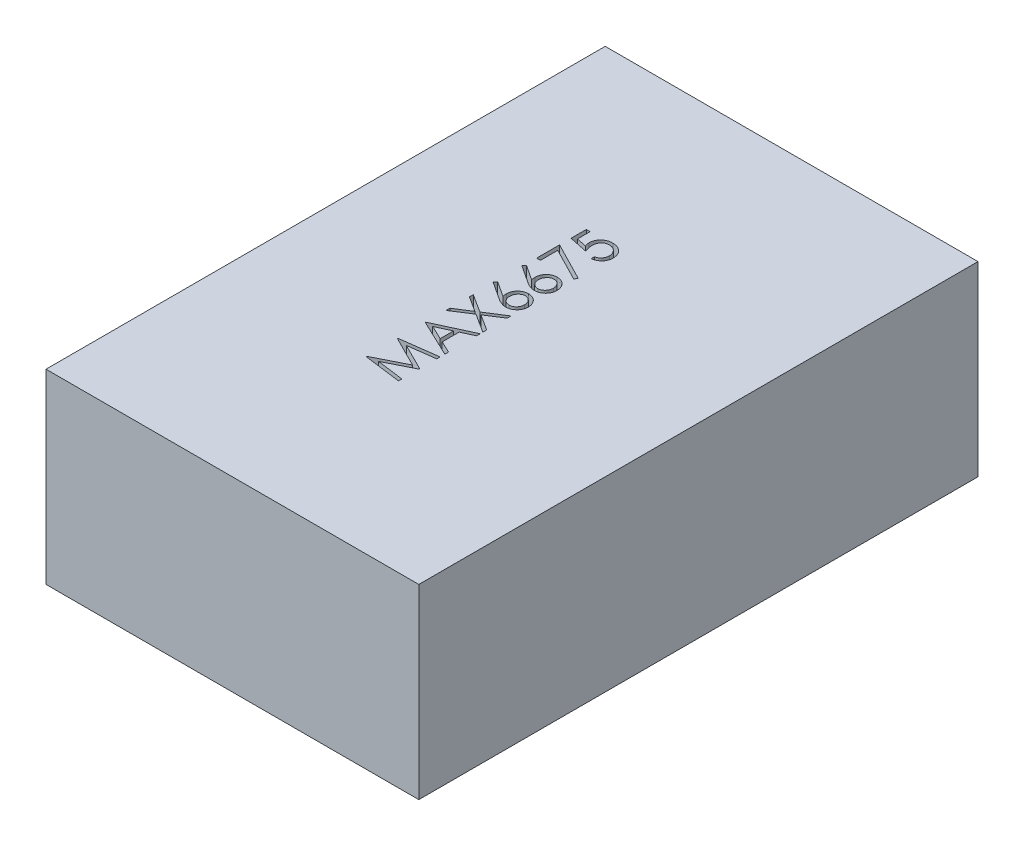
from build123d import *

# Parameters (mm, degrees)
SKETCH1_W           = 20
SKETCH1_H           = 30
BOSS_EXTRUDE1_DEPTH = 10
CUT_EXTRUDE1_DEPTH  = 2


with BuildPart() as part:
    # Sketch1 → Boss-Extrude1 (new body)
    with BuildSketch(Plane(origin=(0, 0, 0), x_dir=(1, 0, 0), z_dir=(0, 1, 0))):
        Rectangle(SKETCH1_W, SKETCH1_H)
    extrude(amount=BOSS_EXTRUDE1_DEPTH)

    # Sketch2 → Cut-Extrude1 (cut)
    # profile 1 of 7: a face of its own
    with BuildSketch(Plane(origin=(0, 10, 0), x_dir=(1, 0, 0), z_dir=(0, 1, 0))):
        Polygon((0, -6.08974359), (-2, -5.825721154), (-2, -5.800080128), (-0.358974359, -4.974358974), (-2, -4.150641026), (-2, -4.124599359), (0, -3.858974359), (0, -4.039262821), (-1.439102564, -4.230769231), (0, -4.952724359), (0, -4.993189103), (-1.442307692, -5.717948718), (0, -5.909054487), align=None)
    # profile 2 of 7: a face of its own
    with BuildSketch(Plane(origin=(0, 10, 0), x_dir=(1, 0, 0), z_dir=(0, 1, 0))):
        Polygon((-2, -2.628205128), (0, -1.705128205), (0, -1.900240385), (-0.641025641, -2.195913462), (-0.641025641, -3.102564103), (0, -3.406650641), (0, -3.602564103), (-2, -2.653846154), align=None)
        Polygon((-1.610176282, -2.643028846), (-0.846153846, -3.005208333), (-0.846153846, -2.290464744), align=None, mode=Mode.SUBTRACT)
    # profile 3 of 7: a face of its own
    with BuildSketch(Plane(origin=(0, 10, 0), x_dir=(1, 0, 0), z_dir=(0, 1, 0))):
        Polygon((-2, -1.538461538), (-2, -1.331330128), (-1.181891026, -0.807692308), (-2, -0.284054487), (-2, -0.076923077), (-1.020032051, -0.703926282), (0, -0.051282051), (0, -0.258413462), (-0.858173077, -0.807692308), (0, -1.356971154), (0, -1.564102564), (-1.020032051, -0.911057692), align=None)
    # profile 4 of 7: a face of its own
    with BuildSketch(Plane(origin=(0, 10, 0), x_dir=(1, 0, 0), z_dir=(0, 1, 0))):
        with BuildLine():
            Line((-2.051282051, 1.038461538), (-1.942708333, 1.176682692))
            Line((-1.942708333, 1.176682692), (-1.134615385, 0.648237179))
            add(Edge.make_bspline(
                [(-1.134615385, 0.648237179), (-1.140223305, 0.683420195), (-1.151162188, 0.752048644), (-1.152966728, 0.821514872), (-1.153846154, 0.85536859)],
                knots=[0, 0, 0, 0, 1.025318673, 2, 2, 2, 2], degree=3))
            add(Edge.make_bspline(
                [(-1.153846154, 0.85536859), (-1.153299804, 0.875695731), (-1.152224332, 0.915709102), (-1.143947845, 0.974455846), (-1.130904925, 1.030906669), (-1.111892204, 1.084827582), (-1.087605157, 1.136412173), (-1.058497181, 1.185956286), (-1.023065556, 1.232529296), (-0.983484842, 1.276728303), (-0.939649317, 1.316864276), (-0.893124314, 1.352371016), (-0.843913513, 1.382359423), (-0.792027979, 1.406251354), (-0.737873866, 1.425345238), (-0.681239969, 1.438937759), (-0.622030702, 1.447063572), (-0.581756259, 1.448160661), (-0.561298077, 1.448717949)],
                knots=[0, 0, 0, 0, 1.043709831, 2.054511743, 3.041122595, 4.01515914, 4.98481438, 5.965901842, 6.960491961, 7.985277438, 9.0096037, 10.00832444, 10.987059228, 11.962929573, 12.936966118, 13.931840027, 14.949438142, 16, 16, 16, 16], degree=3))
            add(Edge.make_bspline(
                [(-0.561298077, 1.448717949), (-0.533308627, 1.447906722), (-0.478232014, 1.446310421), (-0.398031716, 1.430337162), (-0.321672093, 1.405701555), (-0.250474443, 1.369925289), (-0.183945646, 1.326329403), (-0.125190964, 1.272511651), (-0.072791153, 1.211142169), (-0.028992085, 1.14171368), (0.006782366, 1.06700544), (0.032476451, 0.988518047), (0.048295665, 0.907016962), (0.050278855, 0.851700024), (0.051282051, 0.823717949)],
                knots=[0, 0, 0, 0, 1.031403119, 2.029557249, 3.004870281, 3.983165322, 4.960181699, 5.929903783, 6.912123683, 7.928973898, 8.949315281, 9.960468141, 10.968302741, 12, 12, 12, 12], degree=3))
            add(Edge.make_bspline(
                [(0.051282051, 0.823717949), (0.050411272, 0.796804416), (0.048686412, 0.743493419), (0.033241009, 0.665091246), (0.008384705, 0.589622909), (-0.026577342, 0.518057149), (-0.069992888, 0.451652249), (-0.121895145, 0.391768381), (-0.182356218, 0.340010479), (-0.250053485, 0.29654942), (-0.322697467, 0.261932696), (-0.398575063, 0.236215664), (-0.47736772, 0.221114524), (-0.530786503, 0.219009147), (-0.557692308, 0.217948718)],
                knots=[0, 0, 0, 0, 1.012172929, 2.004937354, 2.995255351, 3.995689452, 4.993936421, 5.973737378, 6.968231049, 7.979117505, 8.993136101, 9.989812463, 10.987515067, 12, 12, 12, 12], degree=3))
            add(Edge.make_bspline(
                [(-0.557692308, 0.217948718), (-0.578289212, 0.218623829), (-0.620344156, 0.220002278), (-0.684037887, 0.229627072), (-0.749209933, 0.245092669), (-0.804498044, 0.26241281), (-0.849790342, 0.280713159), (-0.886306623, 0.295943181), (-0.923884379, 0.314899751), (-0.963812171, 0.335113111), (-1.005060989, 0.358402751), (-1.048320229, 0.383725979), (-1.092901902, 0.411782922), (-1.123155728, 0.431451587), (-1.138621795, 0.44150641)],
                knots=[0, 0, 0, 0, 1.173818275, 2.396712641, 3.66331629, 4.989737886, 5.693666774, 6.447286557, 7.243889047, 8.091586357, 8.998013824, 9.943181721, 10.948533338, 12, 12, 12, 12], degree=3))
            Line((-1.138621795, 0.44150641), (-2.051282051, 1.038461538))
        make_face()
        with BuildLine():
            add(Edge.make_bspline(
                [(-0.948717949, 0.817708333), (-0.948277645, 0.802471281), (-0.947417603, 0.77270889), (-0.942314563, 0.729068272), (-0.93302645, 0.687631269), (-0.920147671, 0.648385854), (-0.904269644, 0.611089923), (-0.883896741, 0.576482578), (-0.860166958, 0.543851678), (-0.833123225, 0.51371858), (-0.80353394, 0.48639145), (-0.771836061, 0.462859794), (-0.738799635, 0.442561171), (-0.704147027, 0.426057303), (-0.667891903, 0.413205824), (-0.630200899, 0.403909682), (-0.590821296, 0.39873611), (-0.564117009, 0.397875406), (-0.550480769, 0.397435897)],
                knots=[0, 0, 0, 0, 1.129656352, 2.206547016, 3.251334079, 4.271920891, 5.265058649, 6.249872215, 7.241923875, 8.251504132, 9.246416584, 10.222533834, 11.173322129, 12.116503788, 13.062124155, 14.020151864, 14.989013135, 16, 16, 16, 16], degree=3))
            add(Edge.make_bspline(
                [(-0.550480769, 0.397435897), (-0.536968856, 0.397806493), (-0.510341974, 0.398536797), (-0.47125643, 0.404754602), (-0.433729478, 0.414693113), (-0.397902151, 0.429049963), (-0.36308666, 0.446496396), (-0.330369815, 0.468890236), (-0.298691848, 0.494591857), (-0.269524624, 0.524600848), (-0.242446962, 0.557052446), (-0.218681258, 0.591650452), (-0.19858489, 0.627873935), (-0.181932829, 0.665618569), (-0.169674537, 0.705350925), (-0.160290148, 0.746425849), (-0.155159575, 0.789401805), (-0.154289707, 0.818497291), (-0.153846154, 0.833333333)],
                knots=[0, 0, 0, 0, 0.989367052, 1.949669134, 2.891858276, 3.827522767, 4.772653562, 5.738670152, 6.725809442, 7.756636004, 8.798867547, 9.819240912, 10.826537776, 11.829883227, 12.835515726, 13.868058748, 14.912904531, 16, 16, 16, 16], degree=3))
            add(Edge.make_bspline(
                [(-0.153846154, 0.833333333), (-0.154289742, 0.848169351), (-0.155159677, 0.87726479), (-0.160289759, 0.920241091), (-0.169675962, 0.961314738), (-0.181927668, 1.001051735), (-0.198604154, 1.038779157), (-0.218555494, 1.074970977), (-0.24259268, 1.109241761), (-0.269478132, 1.141714478), (-0.298858516, 1.171598756), (-0.33008438, 1.197904853), (-0.363348444, 1.21959906), (-0.397765257, 1.237737231), (-0.433750877, 1.251935115), (-0.471250589, 1.261922556), (-0.510343498, 1.268127133), (-0.536969369, 1.268859252), (-0.550480769, 1.269230769)],
                knots=[0, 0, 0, 0, 1.087281468, 2.132306021, 3.165025708, 4.170830268, 5.174347389, 6.181816599, 7.194310624, 8.23672049, 9.267723423, 10.261267456, 11.222032883, 12.171822355, 13.107646935, 14.049997283, 15.01046367, 16, 16, 16, 16], degree=3))
            add(Edge.make_bspline(
                [(-0.550480769, 1.269230769), (-0.564134798, 1.268916316), (-0.590933217, 1.268299147), (-0.630183283, 1.261318604), (-0.668083406, 1.25163725), (-0.704395359, 1.237018368), (-0.738975957, 1.218026084), (-0.771999465, 1.194892604), (-0.803720699, 1.168131543), (-0.833181128, 1.137217074), (-0.860137639, 1.103571552), (-0.883864105, 1.067769091), (-0.904117113, 1.03046253), (-0.92009834, 0.99112635), (-0.932972999, 0.950289817), (-0.942281448, 0.907670948), (-0.9474043, 0.863239432), (-0.948274489, 0.833078677), (-0.948717949, 0.817708333)],
                knots=[0, 0, 0, 0, 0.978259475, 1.920005202, 2.851759169, 3.7803069, 4.719124913, 5.675758531, 6.668034766, 7.691045932, 8.733780038, 9.756656648, 10.768121246, 11.773215211, 12.79725739, 13.836288844, 14.897342417, 16, 16, 16, 16], degree=3))
        make_face(mode=Mode.SUBTRACT)
    # profile 5 of 7: a face of its own
    with BuildSketch(Plane(origin=(0, 10, 0), x_dir=(1, 0, 0), z_dir=(0, 1, 0))):
        with BuildLine():
            Line((-2.051282051, 2.576923077), (-1.942708333, 2.715144231))
            Line((-1.942708333, 2.715144231), (-1.134615385, 2.186698718))
            add(Edge.make_bspline(
                [(-1.134615385, 2.186698718), (-1.140223305, 2.221881733), (-1.151162188, 2.290510183), (-1.152966728, 2.359976411), (-1.153846154, 2.393830128)],
                knots=[0, 0, 0, 0, 1.025318673, 2, 2, 2, 2], degree=3))
            add(Edge.make_bspline(
                [(-1.153846154, 2.393830128), (-1.153299804, 2.414157269), (-1.152224332, 2.454170641), (-1.143947845, 2.512917384), (-1.130904925, 2.569368207), (-1.111892204, 2.62328912), (-1.087605157, 2.674873711), (-1.058497181, 2.724417825), (-1.023065556, 2.770990834), (-0.983484842, 2.815189842), (-0.939649317, 2.855325815), (-0.893124314, 2.890832554), (-0.843913513, 2.920820962), (-0.792027979, 2.944712892), (-0.737873866, 2.963806776), (-0.681239969, 2.977399297), (-0.622030702, 2.985525111), (-0.581756259, 2.9866222), (-0.561298077, 2.987179487)],
                knots=[0, 0, 0, 0, 1.043709831, 2.054511743, 3.041122595, 4.01515914, 4.98481438, 5.965901842, 6.960491961, 7.985277438, 9.0096037, 10.00832444, 10.987059228, 11.962929573, 12.936966118, 13.931840027, 14.949438142, 16, 16, 16, 16], degree=3))
            add(Edge.make_bspline(
                [(-0.561298077, 2.987179487), (-0.533308627, 2.986368261), (-0.478232014, 2.984771959), (-0.398031716, 2.968798701), (-0.321672093, 2.944163094), (-0.250474443, 2.908386827), (-0.183945646, 2.864790942), (-0.125190964, 2.810973189), (-0.072791153, 2.749603708), (-0.028992085, 2.680175219), (0.006782366, 2.605466978), (0.032476451, 2.526979585), (0.048295665, 2.4454785), (0.050278855, 2.390161562), (0.051282051, 2.362179487)],
                knots=[0, 0, 0, 0, 1.031403119, 2.029557249, 3.004870281, 3.983165322, 4.960181699, 5.929903783, 6.912123683, 7.928973898, 8.949315281, 9.960468141, 10.968302741, 12, 12, 12, 12], degree=3))
            add(Edge.make_bspline(
                [(0.051282051, 2.362179487), (0.050411272, 2.335265954), (0.048686412, 2.281954957), (0.033241009, 2.203552785), (0.008384705, 2.128084448), (-0.026577342, 2.056518687), (-0.069992888, 1.990113788), (-0.121895145, 1.93022992), (-0.182356218, 1.878472018), (-0.250053485, 1.835010959), (-0.322697467, 1.800394234), (-0.398575063, 1.774677203), (-0.47736772, 1.759576062), (-0.530786503, 1.757470686), (-0.557692308, 1.756410256)],
                knots=[0, 0, 0, 0, 1.012172929, 2.004937354, 2.995255351, 3.995689452, 4.993936421, 5.973737378, 6.968231049, 7.979117505, 8.993136101, 9.989812463, 10.987515067, 12, 12, 12, 12], degree=3))
            add(Edge.make_bspline(
                [(-0.557692308, 1.756410256), (-0.578289212, 1.757085368), (-0.620344156, 1.758463816), (-0.684037887, 1.768088611), (-0.749209933, 1.783554208), (-0.804498044, 1.800874349), (-0.849790342, 1.819174697), (-0.886306623, 1.83440472), (-0.923884379, 1.853361289), (-0.963812171, 1.87357465), (-1.005060989, 1.896864289), (-1.048320229, 1.922187517), (-1.092901902, 1.950244461), (-1.123155728, 1.969913125), (-1.138621795, 1.979967949)],
                knots=[0, 0, 0, 0, 1.173818275, 2.396712641, 3.66331629, 4.989737886, 5.693666774, 6.447286557, 7.243889047, 8.091586357, 8.998013824, 9.943181721, 10.948533338, 12, 12, 12, 12], degree=3))
            Line((-1.138621795, 1.979967949), (-2.051282051, 2.576923077))
        make_face()
        with BuildLine():
            add(Edge.make_bspline(
                [(-0.948717949, 2.356169872), (-0.948277645, 2.340932819), (-0.947417603, 2.311170429), (-0.942314563, 2.267529811), (-0.93302645, 2.226092808), (-0.920147671, 2.186847393), (-0.904269644, 2.149551462), (-0.883896741, 2.114944117), (-0.860166958, 2.082313217), (-0.833123225, 2.052180118), (-0.80353394, 2.024852988), (-0.771836061, 2.001321332), (-0.738799635, 1.981022709), (-0.704147027, 1.964518842), (-0.667891903, 1.951667362), (-0.630200899, 1.942371221), (-0.590821296, 1.937197648), (-0.564117009, 1.936336944), (-0.550480769, 1.935897436)],
                knots=[0, 0, 0, 0, 1.129656352, 2.206547016, 3.251334079, 4.271920891, 5.265058649, 6.249872215, 7.241923875, 8.251504132, 9.246416584, 10.222533834, 11.173322129, 12.116503788, 13.062124155, 14.020151864, 14.989013135, 16, 16, 16, 16], degree=3))
            add(Edge.make_bspline(
                [(-0.550480769, 1.935897436), (-0.536968856, 1.936268031), (-0.510341974, 1.936998335), (-0.47125643, 1.94321614), (-0.433729478, 1.953154652), (-0.397902151, 1.967511502), (-0.36308666, 1.984957935), (-0.330369815, 2.007351774), (-0.298691848, 2.033053395), (-0.269524624, 2.063062386), (-0.242446962, 2.095513985), (-0.218681258, 2.130111991), (-0.19858489, 2.166335474), (-0.181932829, 2.204080107), (-0.169674537, 2.243812463), (-0.160290148, 2.284887388), (-0.155159575, 2.327863344), (-0.154289707, 2.356958829), (-0.153846154, 2.371794872)],
                knots=[0, 0, 0, 0, 0.989367052, 1.949669134, 2.891858276, 3.827522767, 4.772653562, 5.738670152, 6.725809442, 7.756636004, 8.798867547, 9.819240912, 10.826537776, 11.829883227, 12.835515726, 13.868058748, 14.912904531, 16, 16, 16, 16], degree=3))
            add(Edge.make_bspline(
                [(-0.153846154, 2.371794872), (-0.154289742, 2.38663089), (-0.155159677, 2.415726328), (-0.160289759, 2.45870263), (-0.169675962, 2.499776277), (-0.181927668, 2.539513273), (-0.198604154, 2.577240695), (-0.218555494, 2.613432515), (-0.24259268, 2.647703299), (-0.269478132, 2.680176017), (-0.298858516, 2.710060295), (-0.33008438, 2.736366391), (-0.363348444, 2.758060598), (-0.397765257, 2.77619877), (-0.433750877, 2.790396654), (-0.471250589, 2.800384094), (-0.510343498, 2.806588671), (-0.536969369, 2.807320791), (-0.550480769, 2.807692308)],
                knots=[0, 0, 0, 0, 1.087281468, 2.132306021, 3.165025708, 4.170830268, 5.174347389, 6.181816599, 7.194310624, 8.23672049, 9.267723423, 10.261267456, 11.222032883, 12.171822355, 13.107646935, 14.049997283, 15.01046367, 16, 16, 16, 16], degree=3))
            add(Edge.make_bspline(
                [(-0.550480769, 2.807692308), (-0.564134798, 2.807377855), (-0.590933217, 2.806760685), (-0.630183283, 2.799780143), (-0.668083406, 2.790098788), (-0.704395359, 2.775479906), (-0.738975957, 2.756487622), (-0.771999465, 2.733354143), (-0.803720699, 2.706593082), (-0.833181128, 2.675678613), (-0.860137639, 2.64203309), (-0.883864105, 2.60623063), (-0.904117113, 2.568924068), (-0.92009834, 2.529587889), (-0.932972999, 2.488751355), (-0.942281448, 2.446132487), (-0.9474043, 2.401700971), (-0.948274489, 2.371540216), (-0.948717949, 2.356169872)],
                knots=[0, 0, 0, 0, 0.978259475, 1.920005202, 2.851759169, 3.7803069, 4.719124913, 5.675758531, 6.668034766, 7.691045932, 8.733780038, 9.756656648, 10.768121246, 11.773215211, 12.79725739, 13.836288844, 14.897342417, 16, 16, 16, 16], degree=3))
        make_face(mode=Mode.SUBTRACT)
    # profile 6 of 7: a face of its own
    with BuildSketch(Plane(origin=(0, 10, 0), x_dir=(1, 0, 0), z_dir=(0, 1, 0))):
        Polygon((-2, 3.320512821), (-2, 4.551282051), (0.051282051, 3.5), (-0.034054487, 3.344951923), (-1.794871795, 4.247596154), (-1.794871795, 3.320512821), align=None)
    # profile 7 of 7: a face of its own
    with BuildSketch(Plane(origin=(0, 10, 0), x_dir=(1, 0, 0), z_dir=(0, 1, 0))):
        with BuildLine():
            Line((-2, 5.987179487), (-1.794871795, 5.987179487))
            Line((-1.794871795, 5.987179487), (-1.794871795, 5.306891026))
            Line((-1.794871795, 5.306891026), (-1.268830128, 5.19911859))
            add(Edge.make_bspline(
                [(-1.268830128, 5.19911859), (-1.274675998, 5.220293375), (-1.286001446, 5.261316173), (-1.298576172, 5.321864665), (-1.306156425, 5.379345924), (-1.30719146, 5.416646135), (-1.307692308, 5.434695513)],
                knots=[0, 0, 0, 0, 1.100273476, 2.13160584, 3.095893838, 4, 4, 4, 4], degree=3))
            add(Edge.make_bspline(
                [(-1.307692308, 5.434695513), (-1.30722488, 5.457033178), (-1.3063058, 5.500954609), (-1.296956564, 5.565117069), (-1.283414956, 5.626675546), (-1.262551547, 5.684721136), (-1.237073603, 5.740172178), (-1.204983576, 5.792076367), (-1.167518548, 5.841162181), (-1.124871473, 5.887090363), (-1.077448262, 5.928560648), (-1.026247962, 5.964596959), (-0.972387851, 5.996049973), (-0.914605557, 6.020580501), (-0.853990875, 6.040599806), (-0.789844104, 6.053800585), (-0.722734727, 6.062618133), (-0.676845869, 6.063601242), (-0.653445513, 6.064102564)],
                knots=[0, 0, 0, 0, 1.052805225, 2.070078116, 3.052532748, 4.020689046, 4.973125432, 5.925915817, 6.89216474, 7.881560752, 8.877013184, 9.857446635, 10.830895175, 11.812622661, 12.812548702, 13.836681939, 14.896847428, 16, 16, 16, 16], degree=3))
            add(Edge.make_bspline(
                [(-0.653445513, 6.064102564), (-0.637147203, 6.063722179), (-0.604770841, 6.062966549), (-0.556686948, 6.059132375), (-0.509628026, 6.051721865), (-0.46368035, 6.041893227), (-0.418800888, 6.02877248), (-0.37473836, 6.013425381), (-0.331975249, 5.994349954), (-0.290322686, 5.973202711), (-0.250257372, 5.949786126), (-0.212739946, 5.923454696), (-0.17691425, 5.896094824), (-0.143844254, 5.866199112), (-0.113401684, 5.834107458), (-0.085436041, 5.799998425), (-0.059445425, 5.764181385), (-0.03649252, 5.726092225), (-0.015370736, 5.686582356), (0.001956974, 5.645080485), (0.017448712, 5.602531522), (0.029797011, 5.55832302), (0.039472757, 5.512555127), (0.046044529, 5.465152398), (0.050831064, 5.416363444), (0.051130697, 5.383292008), (0.051282051, 5.366586538)],
                knots=[0, 0, 0, 0, 1.056393913, 2.098511576, 3.122979385, 4.141471433, 5.141222888, 6.151259816, 7.162667642, 8.172852865, 9.177685681, 10.166741883, 11.141342384, 12.097242845, 13.052202613, 14.005160326, 14.953864445, 15.917140761, 16.884916217, 17.854238259, 18.828761908, 19.81781811, 20.826036654, 21.857789401, 22.917898972, 24, 24, 24, 24], degree=3))
            add(Edge.make_bspline(
                [(0.051282051, 5.366586538), (0.050886225, 5.346658943), (0.050107484, 5.307453754), (0.041997769, 5.250006186), (0.03030598, 5.19476715), (0.01298396, 5.14197339), (-0.00969799, 5.091845088), (-0.036647579, 5.043664418), (-0.068730651, 4.998028557), (-0.105653755, 4.955249505), (-0.146224468, 4.915926073), (-0.189830035, 4.880267295), (-0.236525992, 4.848916645), (-0.286160498, 4.821760401), (-0.338645513, 4.798625755), (-0.394142756, 4.780443809), (-0.452371772, 4.765770998), (-0.492459431, 4.759563256), (-0.512820513, 4.756410256)],
                knots=[0, 0, 0, 0, 1.046872515, 2.059598001, 3.044168548, 4.012104806, 4.973680974, 5.932408326, 6.910122221, 7.900780896, 8.89867654, 9.876692837, 10.858029398, 11.85084981, 12.847361615, 13.868568023, 14.917415949, 16, 16, 16, 16], degree=3))
            Line((-0.512820513, 4.756410256), (-0.512820513, 4.935897436))
            add(Edge.make_bspline(
                [(-0.512820513, 4.935897436), (-0.493746269, 4.940310992), (-0.457084512, 4.948794091), (-0.405607314, 4.967462714), (-0.35971864, 4.990066695), (-0.31913792, 5.017571802), (-0.283122332, 5.049453742), (-0.251367469, 5.08651485), (-0.222684156, 5.12782861), (-0.198734154, 5.173761398), (-0.178559507, 5.222314576), (-0.164162216, 5.272842061), (-0.155447226, 5.324616663), (-0.154381853, 5.359475303), (-0.153846154, 5.377003205)],
                knots=[0, 0, 0, 0, 1.13623081, 2.183898708, 3.172478118, 4.09966615, 5.022692284, 5.957376522, 6.927682873, 7.937366477, 8.960015386, 9.976409503, 10.982481913, 12, 12, 12, 12], degree=3))
            add(Edge.make_bspline(
                [(-0.153846154, 5.377003205), (-0.154319094, 5.394120864), (-0.155250317, 5.427825674), (-0.162302036, 5.477453011), (-0.173447767, 5.525226299), (-0.189062297, 5.571230342), (-0.209719405, 5.615239086), (-0.235095471, 5.657190307), (-0.264557386, 5.697681636), (-0.298231279, 5.735647404), (-0.335361005, 5.770410971), (-0.375061279, 5.801129233), (-0.417414049, 5.826715915), (-0.461684346, 5.848278297), (-0.508357828, 5.864651601), (-0.557215637, 5.876332164), (-0.608378484, 5.883191054), (-0.643275232, 5.884134586), (-0.661057692, 5.884615385)],
                knots=[0, 0, 0, 0, 1.027268864, 2.022700798, 3.002744649, 3.968653148, 4.933396556, 5.915045722, 6.907600446, 7.935526002, 8.956456544, 9.95700807, 10.942805781, 11.92166854, 12.907987664, 13.905483474, 14.932689774, 16, 16, 16, 16], degree=3))
            add(Edge.make_bspline(
                [(-0.661057692, 5.884615385), (-0.677102875, 5.884250543), (-0.708376596, 5.88353943), (-0.754291254, 5.877383371), (-0.797804844, 5.86709977), (-0.839106701, 5.852458012), (-0.878064773, 5.83418463), (-0.914593207, 5.811241844), (-0.949035466, 5.78460658), (-0.980505207, 5.753510512), (-1.009596051, 5.719684427), (-1.034305303, 5.682259498), (-1.055318512, 5.642234833), (-1.072535123, 5.599536259), (-1.086249471, 5.554111181), (-1.095727645, 5.505935134), (-1.10139924, 5.454997137), (-1.102168621, 5.420153912), (-1.102564103, 5.40224359)],
                knots=[0, 0, 0, 0, 1.045723156, 2.038222538, 3.013889863, 3.95567481, 4.890389958, 5.81331128, 6.76251276, 7.723027653, 8.692928204, 9.666105983, 10.639751036, 11.635719707, 12.66315958, 13.728667616, 14.832476222, 16, 16, 16, 16], degree=3))
            add(Edge.make_bspline(
                [(-1.102564103, 5.40224359), (-1.102232336, 5.386741345), (-1.101547323, 5.354733142), (-1.09650361, 5.305634384), (-1.088366871, 5.254039113), (-1.077174729, 5.200145116), (-1.0625284, 5.14379054), (-1.044977256, 5.085094311), (-1.023993257, 5.023933016), (-1.008146278, 4.982722887), (-1, 4.961538462)],
                knots=[0, 0, 0, 0, 0.817624296, 1.688186739, 2.600797293, 3.572016777, 4.590301741, 5.671205678, 6.80286297, 8, 8, 8, 8], degree=3))
            Line((-1, 4.961538462), (-2, 5.166666667))
            Line((-2, 5.166666667), (-2, 5.987179487))
        make_face()
    extrude(amount=-CUT_EXTRUDE1_DEPTH, mode=Mode.SUBTRACT)


solid = part.part
